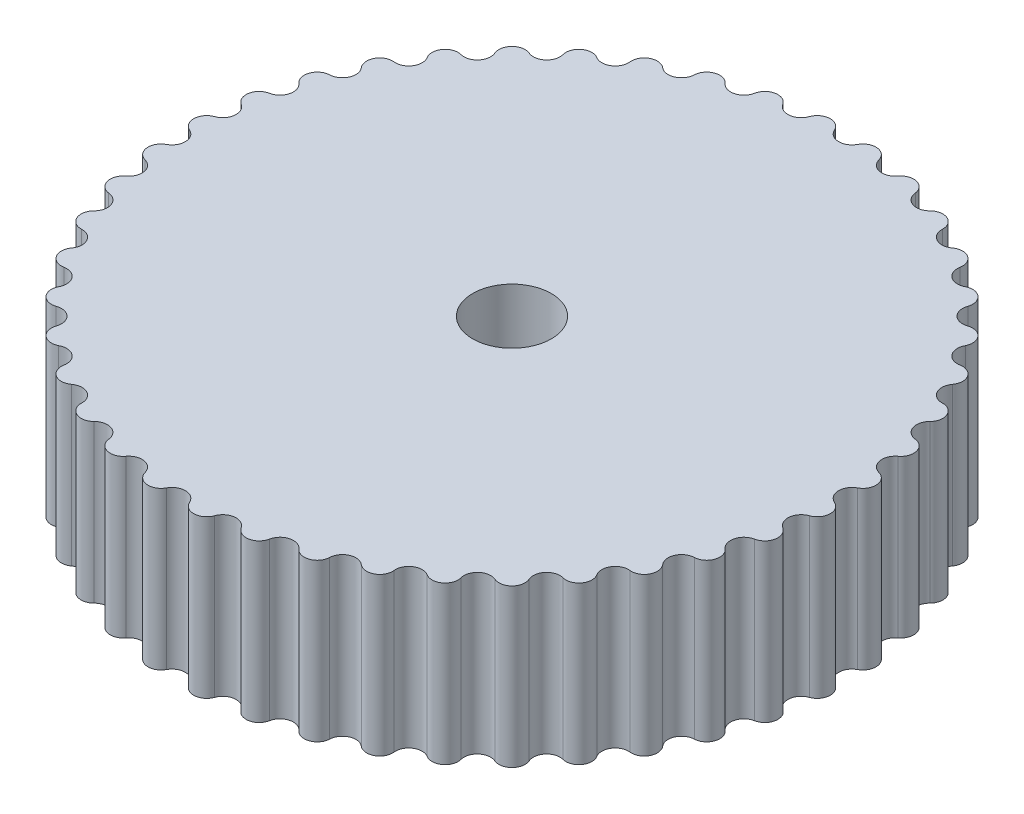
from build123d import *

# Parameters (mm, degrees)
BOSS_EXTRUDE1_DEPTH = 20
CIRPATTERN1_COUNT   = 42


with BuildPart() as part:
    # Sketch1 → Boss-Extrude1 (new body)
    with BuildSketch(Plane(origin=(0, 0, 0), x_dir=(1, 0, 0), z_dir=(0, 1, 0))):
        with BuildLine():
            Line((0, 41), (0, 5))
            ThreePointArc((0, 5), (0.373650468, 4.986018986), (0.745211331, 4.944154131))
            Line((0.745211331, 4.944154131), (6.110732913, 40.542063875))
            ThreePointArc((6.110732913, 40.542063875), (4.702507996, 41.735912816), (3.063933837, 40.885355684))
            ThreePointArc((3.063933837, 40.885355684), (1.495647771, 39.972028192), (0, 41))
        make_face()
    boss_extrude1 = extrude(amount=BOSS_EXTRUDE1_DEPTH)

    # CirPattern1: Boss-Extrude1 ×42 about axis
    cirpattern1_axis = Axis((0, 0, 0), (0, 1, 0))
    for i in range(1, CIRPATTERN1_COUNT):
        add(boss_extrude1.rotate(cirpattern1_axis, i * 360 / CIRPATTERN1_COUNT))


solid = part.part
